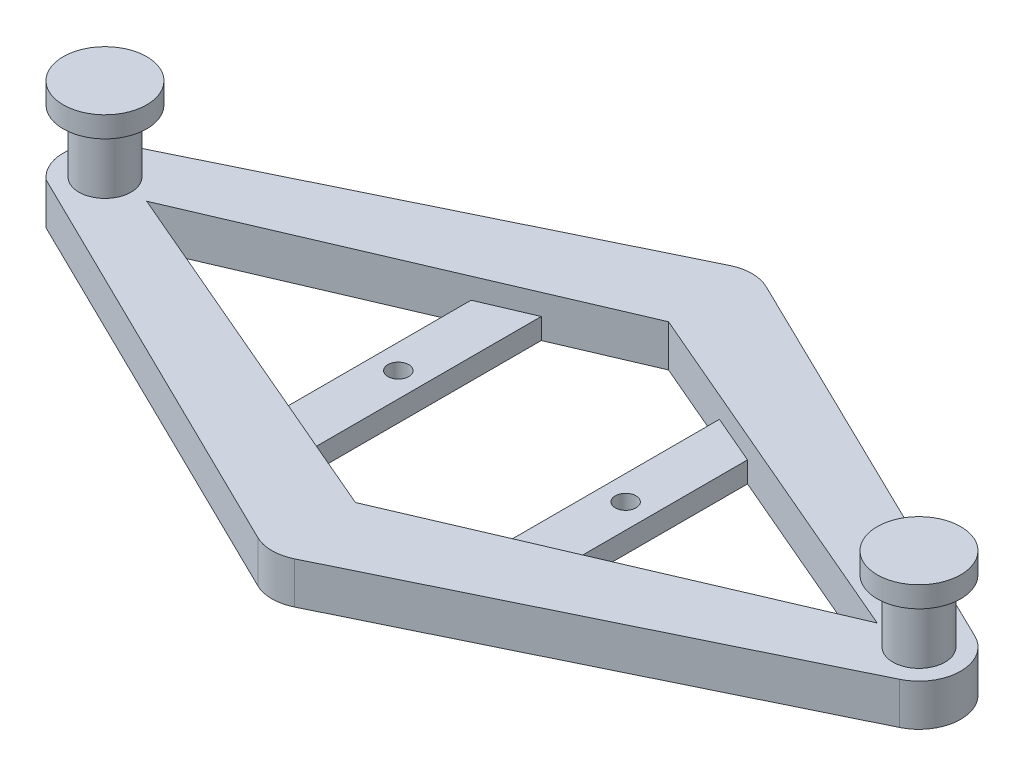
from build123d import *

# Parameters (mm, degrees)
BOSS_EXTRUDE1_DEPTH   = 5.08
SKETCH5_R             = 3.175
BOSS_EXTRUDE2_DEPTH   = 7.62
SKETCH12_R            = 5.08
BOSS_EXTRUDE4_DEPTH   = 2.54
SKETCH14_R            = 5.08
BOSS_EXTRUDE5_DEPTH   = 2.54
SKETCH15_R            = 1.27
BOSS_EXTRUDE6_DEPTH   = 2.54
BOSS_EXTRUDE6_2_DEPTH = 2.54


with BuildPart() as part:
    # Sketch4 → Boss-Extrude1 (new body)
    with BuildSketch(Plane(origin=(0, 0, 0), x_dir=(1, 0, 0), z_dir=(0, 1, 0))):
        with BuildLine():
            Line((-51.75488467, 4.566868534), (-2.22488467, 28.696868534))
            ThreePointArc((-2.22488467, 28.696868534), (1.2433e-05, 29.21), (2.224907024, 28.696857643))
            Line((2.224907024, 28.696857643), (51.70773276, 4.589540285))
            ThreePointArc((51.70773276, 4.589540285), (54.609932644, 0.026159658), (51.75488467, -4.566868534))
            Line((51.75488467, -4.566868534), (2.22488467, -28.696868534))
            ThreePointArc((2.22488467, -28.696868534), (-0.00727814, -29.209994786), (-2.237961471, -28.690474587))
            Line((-2.237961471, -28.690474587), (-52.826499461, -3.865163813))
            ThreePointArc((-52.826499461, -3.865163813), (-54.569465553, 0.640458386), (-51.75488467, 4.566868534))
        make_face()
        Polygon((-44.45, 0), (0, 19.05), (44.45, 0), (0, -19.05), align=None, mode=Mode.SUBTRACT)
    extrude(amount=BOSS_EXTRUDE1_DEPTH)

    # Sketch5 → Boss-Extrude2 (add)
    with BuildSketch(Plane(origin=(0, 5.08, 0), x_dir=(1, 0, 0), z_dir=(0, 1, 0))):
        with Locations(Location((-49.53, 0, 0), (0, 0, 90))):
            Circle(SKETCH5_R)
        with Locations(Location((49.53, 0, 0), (0, 0, 90))):
            Circle(SKETCH5_R)
    extrude(amount=BOSS_EXTRUDE2_DEPTH)

    # Sketch12 → Boss-Extrude4 (add)
    with BuildSketch(Plane(origin=(0, 12.7, 0), x_dir=(1, 0, 0), z_dir=(0, 1, 0))):
        with Locations(Location((49.53, 0, 0), (0, 0, 270))):
            Circle(SKETCH12_R)
    extrude(amount=BOSS_EXTRUDE4_DEPTH)

    # Sketch14 → Boss-Extrude5 (add)
    with BuildSketch(Plane(origin=(0, 12.7, 0), x_dir=(1, 0, 0), z_dir=(0, 1, 0))):
        with Locations(Location((-49.53, 0, 0), (0, 0, 270))):
            Circle(SKETCH14_R)
    extrude(amount=BOSS_EXTRUDE5_DEPTH)


with BuildPart() as body_2:
    # Sketch15 → Boss-Extrude6 (new body)
    with BuildSketch(Plane(origin=(0, 0, 0), x_dir=(1, 0, 0), z_dir=(0, 1, 0))):
        Polygon((-10.839034868, 14.404699342), (-10.839034868, -14.404699342), (-16.823699484, -11.839843078), (-16.823699484, 11.839843078), align=None)
        with Locations(Location((-13.831367176, 0, 0), (0, 0, 270))):
            Circle(SKETCH15_R, mode=Mode.SUBTRACT)
    extrude(amount=BOSS_EXTRUDE6_DEPTH)


with BuildPart() as body_3:
    # Sketch15 → Boss-Extrude6 2 (new body)
    with BuildSketch(Plane(origin=(0, 0, 0), x_dir=(1, 0, 0), z_dir=(0, 1, 0))):
        Polygon((16.823699484, 11.839843078), (10.839034868, 14.404699342), (10.839034868, -14.404699342), (16.823699484, -11.839843078), align=None)
        with Locations(Location((13.831367176, 0, 0), (0, 0, 90))):
            Circle(SKETCH15_R, mode=Mode.SUBTRACT)
    extrude(amount=BOSS_EXTRUDE6_2_DEPTH)


solid = Compound([part.part, body_2.part, body_3.part])
